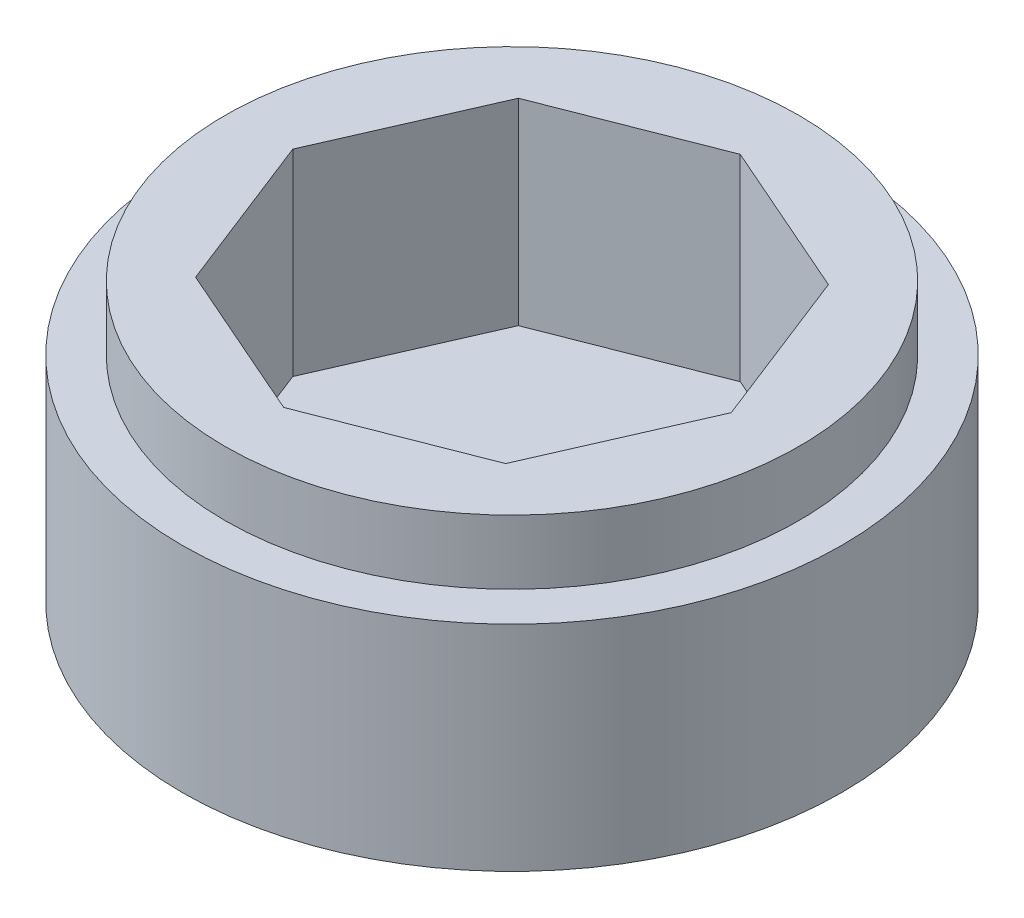
from build123d import *

# Parameters (mm, degrees)
SKETCH1_R           = 3.85
BOSS_EXTRUDE1_DEPTH = 2.5
SKETCH2_R           = 3.35
BOSS_EXTRUDE2_DEPTH = 0.75
CUT_EXTRUDE1_DEPTH  = 2.3


with BuildPart() as part:
    # Sketch1 → Boss-Extrude1 (new body)
    with BuildSketch(Plane(origin=(0, 0, 0), x_dir=(1, 0, 0), z_dir=(0, 1, 0))):
        with Locations(Location((0, 0, 0), (0, 0, 270))):
            Circle(SKETCH1_R)
    extrude(amount=BOSS_EXTRUDE1_DEPTH)

    # Sketch2 → Boss-Extrude2 (add)
    with BuildSketch(Plane(origin=(0, 2.5, 0), x_dir=(1, 0, 0), z_dir=(0, 1, 0))):
        with Locations(Location((0, 0, 0), (0, 0, 270))):
            Circle(SKETCH2_R)
    extrude(amount=BOSS_EXTRUDE2_DEPTH)

    # Sketch3 → Cut-Extrude1 (cut)
    with BuildSketch(Plane(origin=(0, 3.25, 0), x_dir=(1, 0, 0), z_dir=(0, 1, 0))):
        Polygon((-0.052616599, -2.612596145), (1.810178897, -1.884590005), (2.612596145, -0.052616599), (1.884590005, 1.810178897), (0.052616599, 2.612596145), (-1.810178897, 1.884590005), (-2.612596145, 0.052616599), (-1.884590005, -1.810178897), align=None)
    extrude(amount=-CUT_EXTRUDE1_DEPTH, mode=Mode.SUBTRACT)


solid = part.part
